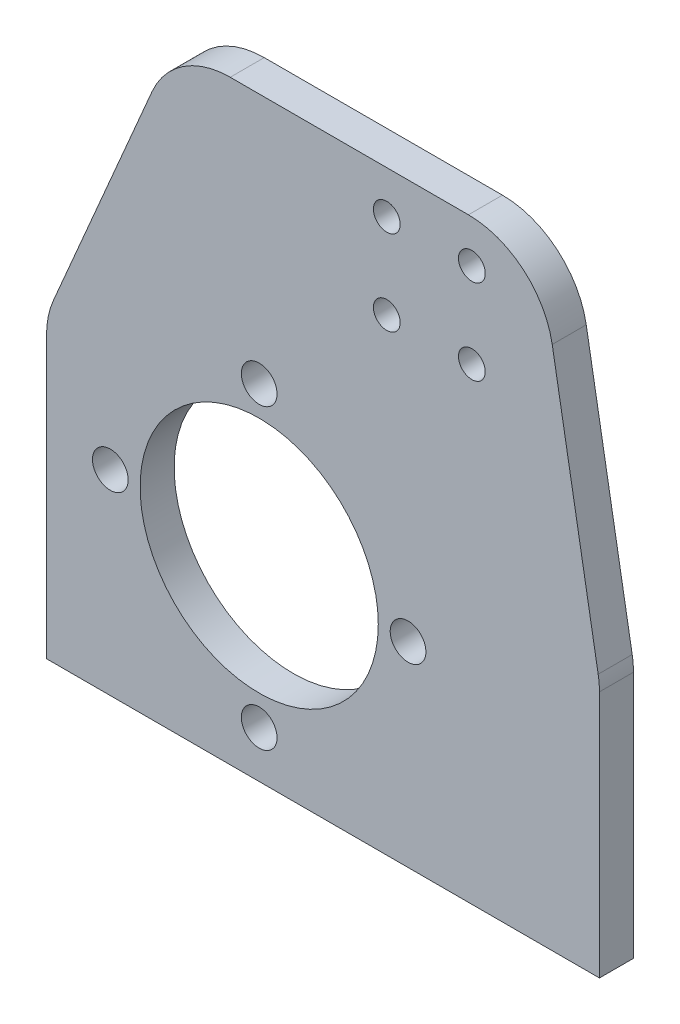
from build123d import *

# Parameters (mm, degrees)
SKETCH_1_W          = 65
SKETCH_1_H          = 70
EXTRUDE_1_DEPTH     = 4
SKETCH_2_R          = 2.1
SKETCH_2_R_2        = 1.575
SKETCH_2_R_3        = 14
CUT_EXTRUDE_1_DEPTH = 96.608577021
CUT_EXTRUDE_2_DEPTH = 96.608577021
FILLET_1_R          = 10


with BuildPart() as part:
    # 草图1 → 凸台-拉伸1 (new body)
    with BuildSketch(Plane.XY):
        with Locations((32.5, -35)):
            Rectangle(SKETCH_1_W, SKETCH_1_H)
    extrude(amount=EXTRUDE_1_DEPTH)

    # 草图2 → 切除-拉伸1 (cut, through all)
    with BuildSketch(Plane.XY.offset(4)):
        with Locations((25, -29.5)):
            Circle(SKETCH_2_R)
        with Locations((7.5, -47)):
            Circle(SKETCH_2_R)
        with Locations(Location((25, -64.5, 0), (0, 0, 180))):
            Circle(SKETCH_2_R)
        with Locations(Location((42.5, -47, 0), (0, 0, 180))):
            Circle(SKETCH_2_R)
        with Locations((40, -5)):
            Circle(SKETCH_2_R_2)
        with Locations(Location((50, -5, 0), (0, 0, 180))):
            Circle(SKETCH_2_R_2)
        with Locations((50, -15)):
            Circle(SKETCH_2_R_2)
        with Locations(Location((40, -15, 0), (0, 0, 180))):
            Circle(SKETCH_2_R_2)
        with Locations((25, -47)):
            Circle(SKETCH_2_R_3)
    extrude(amount=-CUT_EXTRUDE_1_DEPTH, mode=Mode.SUBTRACT)

    # 草图3 → 切除-拉伸2 (cut, through all)
    with BuildSketch(Plane(origin=(0, 0, 0), x_dir=(-1, 0, 0), z_dir=(0, 0, -1))):
        Polygon((-15, 0), (0, 0), (0, -35), align=None)
        Polygon((-65, 0), (-58, 0), (-65, -40), align=None)
    extrude(amount=-CUT_EXTRUDE_2_DEPTH, mode=Mode.SUBTRACT)

    # 圆角1
    fillet_1_edges = [part.edges().sort_by_distance(p)[0] for p in [
        (0, -35, 2),
        (15, 0, 2),
        (65, -40, 2),
        (58, 0, 2),
    ]]
    fillet(fillet_1_edges, radius=FILLET_1_R)


solid = part.part
